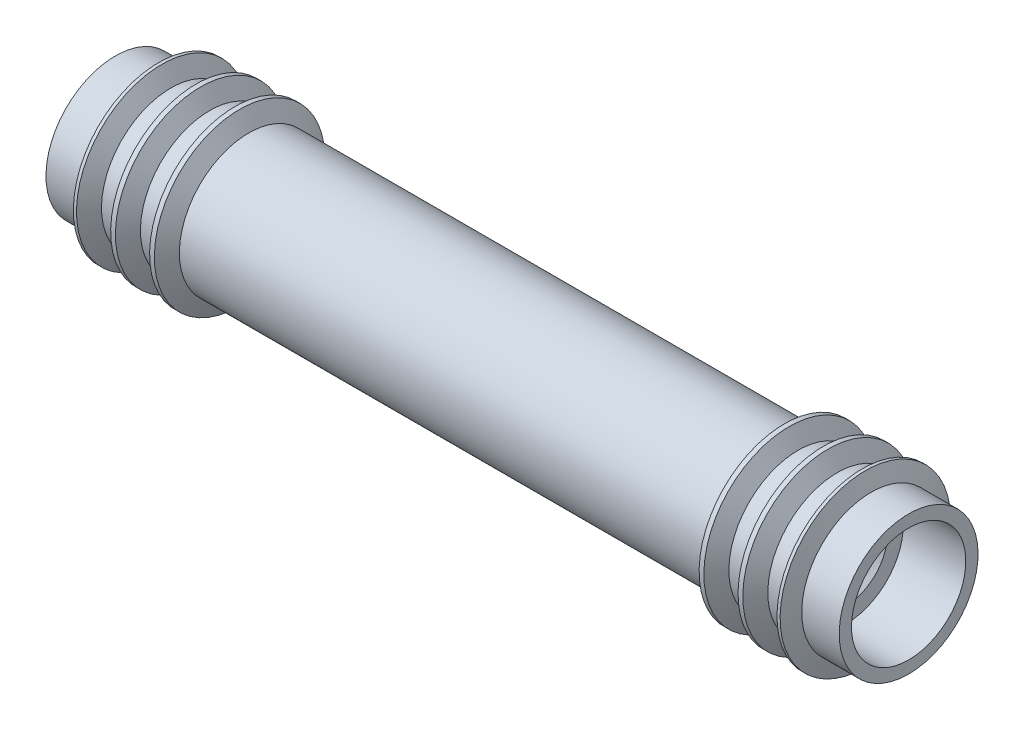
from build123d import *

# Parameters (mm, degrees)
CHAMFER1_SIZE = 0.508


with BuildPart() as part:
    # Sketch2 → Revolve1 (revolve)
    with BuildSketch(Plane.XY, mode=Mode.PRIVATE) as revolve1_sk:
        Polygon((-28.75, 5.55625), (-31.75, 5.55625), (-31.75, 4.575), (-26.75, 4.575), (-26.75, 3.305), (-26.242, 2.797), (-26.242, 1.7145), (-21.925, 1.7145), (-21.925, 0), (0, 0), (0, 3.175), (0, 5.55625), (-21.070060633, 5.55625), (-21.803295474, 6.82625), (-22.184295474, 6.82625), (-22.917530316, 5.55625), (-24.187530316, 5.55625), (-24.920765158, 6.82625), (-25.301765158, 6.82625), (-26.035, 5.55625), (-27.305, 5.55625), (-28.038234842, 6.82625), (-28.287757802, 6.82625), align=None)
    revolve(revolve1_sk.sketch.rotate(Axis((-31.75, 0, 0), (1, 0, 0)), 180), axis=Axis((-31.75, 0, 0), (1, 0, 0)))

    # Mirror1: part across plane


with BuildPart() as part_1:
    add(part.part)
    add(part.part.mirror(Plane(origin=(0, 0, 0), x_dir=(0, 0, 1), z_dir=(1, 0, 0))))

    # Chamfer1
    chamfer1_edges = [part_1.edges().sort_by_distance(p)[0] for p in [
        (-31.75, 4.575, 0),
    ]]
    chamfer(chamfer1_edges, length=CHAMFER1_SIZE)


solid = part_1.part
